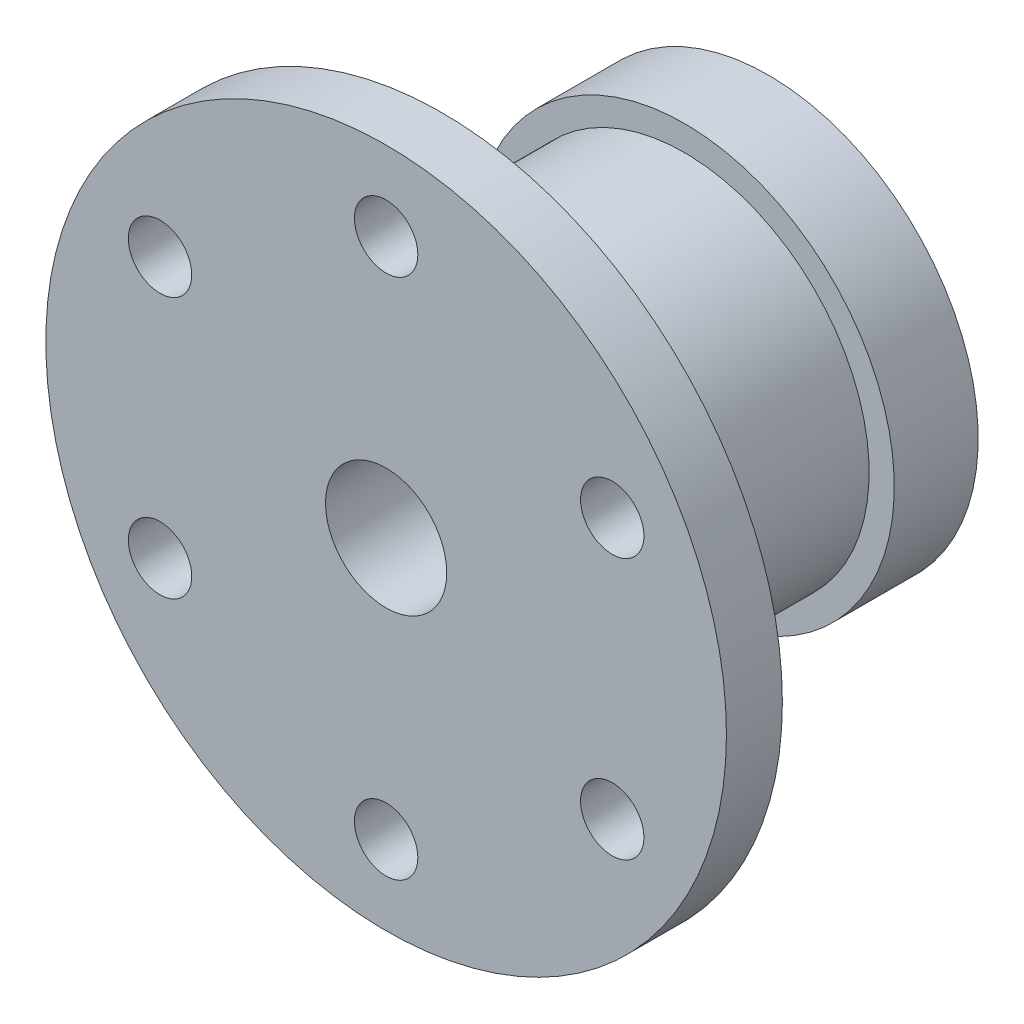
from build123d import *
from build123d.topology import SkipClean

# Parameters (mm, degrees)
SKETCH_36_5_3_R             = 18.25
SKETCH_36_5_3_R_2           = 3.25
EXTRUDE_36_5_3_DEPTH        = 3
EXTRUDE_START               = 17.5
SKETCH_19_8_17_5_R          = 9.9
SKETCH_19_8_17_5_R_2        = 3.25
EXTRUDE_19_8_17_5_DEPTH     = 17.5
SKETCH_22_5_4_5_R           = 11.25
SKETCH_22_5_4_5_R_2         = 3.25
EXTRUDE_22_5_4_5_DEPTH      = 4.5
SKETCH_3_4_28_R             = 1.7
CUT_EXTRUDE_3_4_28_DEPTH    = 3
SKETCH_20_35_0_6_R          = 10.175
CUT_EXTRUDE_20_35_0_6_DEPTH = 0.6
M2X0_4_14_142_2_R           = 0.8
M2X0_4_14_142_DEPTH         = 5


with BuildPart() as part:
    # 轴承端法兰_Ø36.5_厚3_草图 → 轴承端法兰_Ø36.5_厚3 (new body)
    with BuildSketch(Plane.XY):
        Circle(SKETCH_36_5_3_R)
        Circle(SKETCH_36_5_3_R_2, mode=Mode.SUBTRACT)
    extrude(amount=EXTRUDE_36_5_3_DEPTH)

    # 穿轴颈_Ø19.8_长17.5_草图 → 穿轴颈_Ø19.8_长17.5 (add)
    with SkipClean():  # the faces are left unmerged after this step: merging them gives an invalid solid
        with BuildSketch(Plane(origin=(0, 0, 0), x_dir=(-1, 0, 0), z_dir=(0, 0, -1)).offset(EXTRUDE_START)):
            Circle(SKETCH_19_8_17_5_R)
            Circle(SKETCH_19_8_17_5_R_2, mode=Mode.SUBTRACT)
        extrude(amount=-EXTRUDE_19_8_17_5_DEPTH)

    # 舵盘端凸缘_Ø22.5_长4.5_草图 → 舵盘端凸缘_Ø22.5_长4.5 (add)
    with SkipClean():  # the faces are left unmerged after this step: merging them gives an invalid solid
        with BuildSketch(Plane(origin=(0, 0, -17.5), x_dir=(-1, 0, 0), z_dir=(0, 0, -1))):
            Circle(SKETCH_22_5_4_5_R)
            Circle(SKETCH_22_5_4_5_R_2, mode=Mode.SUBTRACT)
        extrude(amount=-EXTRUDE_22_5_4_5_DEPTH)

    # 轴承端_六处Ø3.4_分度圆Ø28_草图 → 轴承端_六处Ø3.4_分度圆Ø28 (cut)
    with SkipClean():  # the faces are left unmerged after this step: merging them gives an invalid solid
        with BuildSketch(Plane.XY.offset(3)):
            with Locations((12.124355653, 7)):
                Circle(SKETCH_3_4_28_R)
            with Locations((0, 14)):
                Circle(SKETCH_3_4_28_R)
            with Locations((-12.124355653, 7)):
                Circle(SKETCH_3_4_28_R)
            with Locations((-12.124355653, -7)):
                Circle(SKETCH_3_4_28_R)
            with Locations((0, -14)):
                Circle(SKETCH_3_4_28_R)
            with Locations((12.124355653, -7)):
                Circle(SKETCH_3_4_28_R)
        extrude(amount=-CUT_EXTRUDE_3_4_28_DEPTH, mode=Mode.SUBTRACT)

    # 舵盘止口_Ø20.35_深0.6_草图 → 舵盘止口_Ø20.35_深0.6 (cut)
    with SkipClean():  # the faces are left unmerged after this step: merging them gives an invalid solid
        with BuildSketch(Plane(origin=(0, 0, -17.5), x_dir=(-1, 0, 0), z_dir=(0, 0, -1))):
            Circle(SKETCH_20_35_0_6_R)
        extrude(amount=-CUT_EXTRUDE_20_35_0_6_DEPTH, mode=Mode.SUBTRACT)

    # M2x0.4__14.142 2 → M2x0.4__14.142 (cut)
    with SkipClean():  # the faces are left unmerged after this step: merging them gives an invalid solid
        with BuildSketch(Plane(origin=(0, 0, -16.9), x_dir=(-1, 0, 0), z_dir=(0, 0, -1))):
            with Locations((-7.071067812, 0)):
                Circle(M2X0_4_14_142_2_R)
            with Locations((0, 7.071067812)):
                Circle(M2X0_4_14_142_2_R)
            with Locations((7.071067812, 0)):
                Circle(M2X0_4_14_142_2_R)
            with Locations((0, -7.071067812)):
                Circle(M2X0_4_14_142_2_R)
        extrude(amount=-M2X0_4_14_142_DEPTH, mode=Mode.SUBTRACT)


solid = part.part
